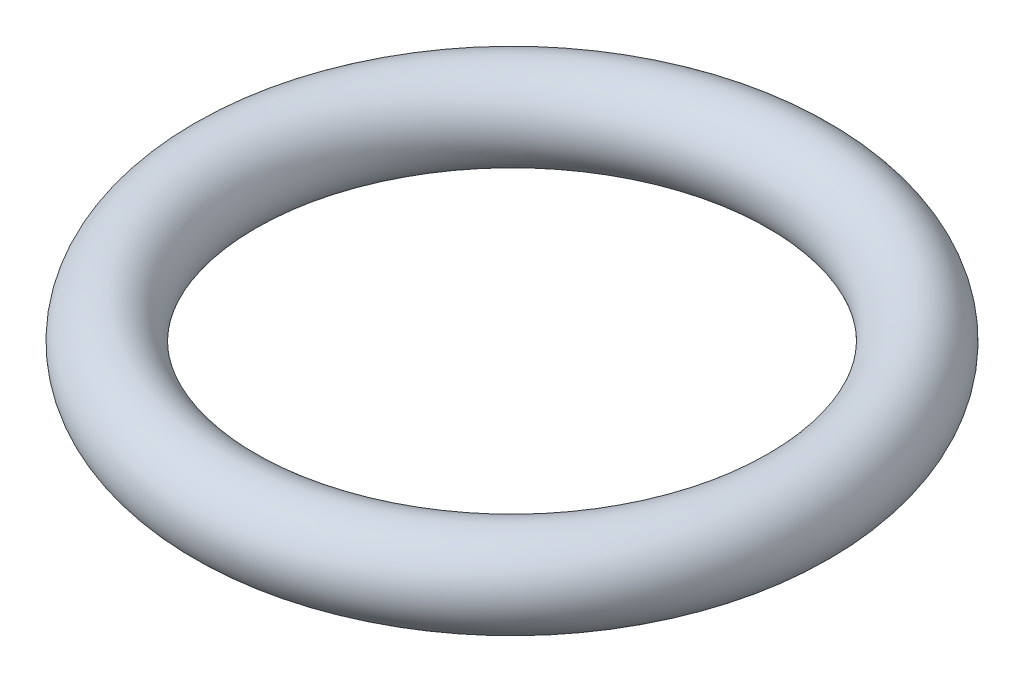
from build123d import *

# Parameters (mm, degrees)
CROQUIS2_R = 0.75


with BuildPart() as part:
    # Croquis2 → Revolución1 (revolve)
    with BuildSketch(Plane.XY, mode=Mode.PRIVATE) as revoluci_n1_sk:
        with Locations((5, 0)):
            Circle(CROQUIS2_R)
    revolve(revoluci_n1_sk.sketch.rotate(Axis((0, 1, 0), (0, -1, 0)), 180), axis=Axis((0, 1, 0), (0, -1, 0)))


solid = part.part
